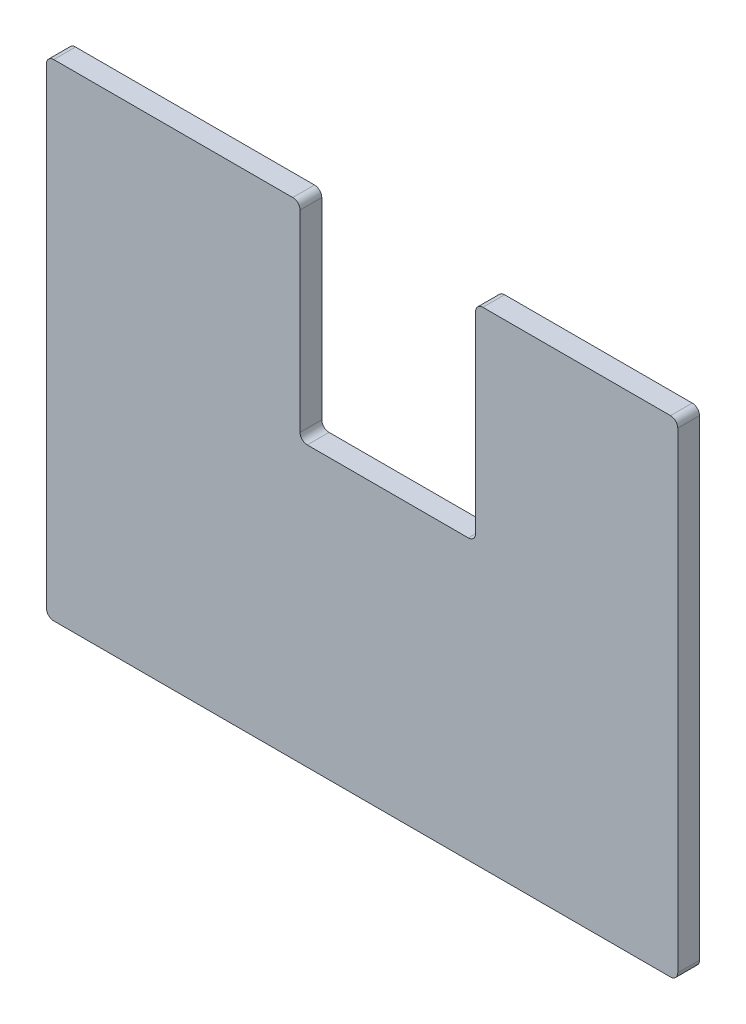
from build123d import *

# Parameters (mm, degrees)
RESSALTO_EXTRUS_O1_DEPTH = 3
FILETE1_R                = 1


with BuildPart() as part:
    # Esboço1 → Ressalto-extrusão1 (new body)
    with BuildSketch(Plane.XY):
        Polygon((-8.50739043, 33.509840055), (-43.485746942, 33.509840055), (-43.485746942, -33.566083295), (43.608248957, -33.566083295), (43.608248957, 33.509840055), (15.716409294, 33.509840055), (15.716409294, 4.953578222), (-8.50739043, 4.953578222), align=None)
    extrude(amount=RESSALTO_EXTRUS_O1_DEPTH)

    # Filete1
    filete1_edges = [part.edges().sort_by_distance(p)[0] for p in [
        (43.608248957, -33.566083295, 1.5),
        (-43.485746942, -33.566083295, 1.5),
        (-43.485746942, 33.509840055, 1.5),
        (-8.50739043, 33.509840055, 1.5),
        (-8.50739043, 4.953578222, 1.5),
        (15.716409294, 4.953578222, 1.5),
        (15.716409294, 33.509840055, 1.5),
        (43.608248957, 33.509840055, 1.5),
    ]]
    fillet(filete1_edges, radius=FILETE1_R)


solid = part.part
